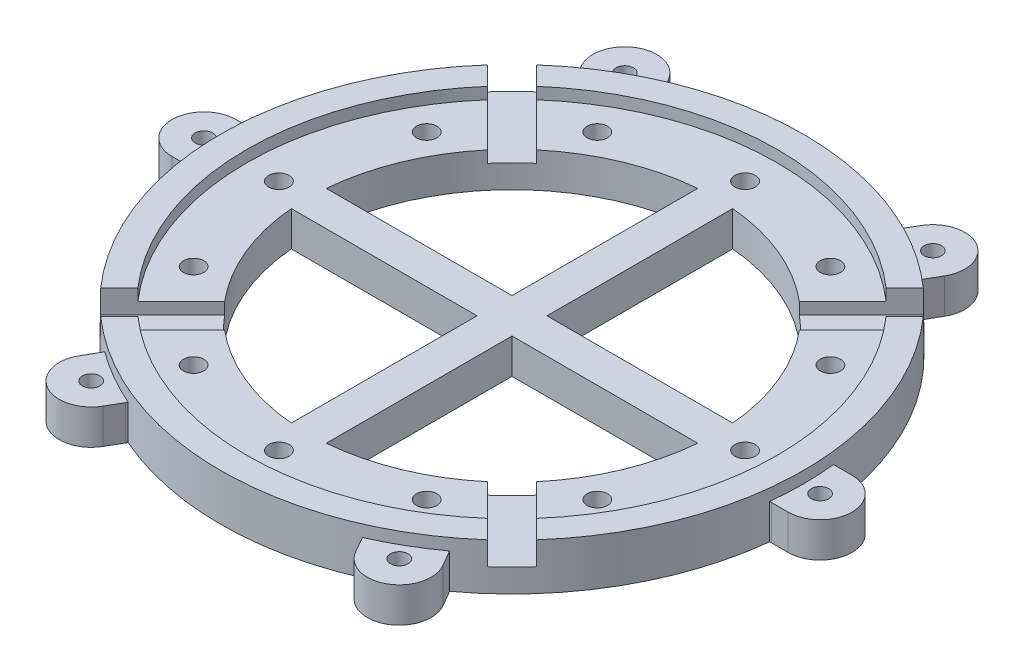
from build123d import *

# Parameters (mm, degrees)
SKETCH1_R           = 50
BOSS_EXTRUDE1_DEPTH = 8
SKETCH2_R           = 45.5
CUT_EXTRUDE1_DEPTH  = 2
SKETCH3_R           = 1.75
CUT_EXTRUDE2_DEPTH  = 72.161787499
SKETCH4_R           = 3.25
CUT_EXTRUDE3_DEPTH  = 3
BOSS_EXTRUDE2_DEPTH = 6
SKETCH6_R           = 1.5
CUT_EXTRUDE4_DEPTH  = 79.087932515
CUT_EXTRUDE6_DEPTH  = 78.908441164
CUT_EXTRUDE9_DEPTH  = 4


with BuildPart() as part:
    # Sketch1 → Boss-Extrude1 (new body)
    with BuildSketch(Plane(origin=(0, 0, 0), x_dir=(1, 0, 0), z_dir=(0, 1, 0))):
        with Locations(Location((0, 0, 0), (0, 0, 270))):
            Circle(SKETCH1_R)
    extrude(amount=BOSS_EXTRUDE1_DEPTH)

    # Sketch2 → Cut-Extrude1 (cut)
    with BuildSketch(Plane(origin=(0, 8, 0), x_dir=(1, 0, 0), z_dir=(0, 1, 0))):
        with Locations(Location((0, 0, 0), (0, 0, 270))):
            Circle(SKETCH2_R)
    extrude(amount=-CUT_EXTRUDE1_DEPTH, mode=Mode.SUBTRACT)

    # Sketch3 → Cut-Extrude2 (cut, through all)
    with BuildSketch(Plane.XZ):
        with Locations(Location((-40, 0, 0), (0, 0, 270))):
            Circle(SKETCH3_R)
        with Locations(Location((-34.641016151, 20, 0), (0, 0, 270))):
            Circle(SKETCH3_R)
        with Locations(Location((-20, 34.641016151, 0), (0, 0, 270))):
            Circle(SKETCH3_R)
        with Locations(Location((0, 40, 0), (0, 0, 270))):
            Circle(SKETCH3_R)
        with Locations(Location((20, 34.641016151, 0), (0, 0, 270))):
            Circle(SKETCH3_R)
        with Locations(Location((34.641016151, 20, 0), (0, 0, 270))):
            Circle(SKETCH3_R)
        with Locations(Location((40, 0, 0), (0, 0, 270))):
            Circle(SKETCH3_R)
        with Locations(Location((34.641016151, -20, 0), (0, 0, 270))):
            Circle(SKETCH3_R)
        with Locations(Location((20, -34.641016151, 0), (0, 0, 270))):
            Circle(SKETCH3_R)
        with Locations(Location((0, -40, 0), (0, 0, 270))):
            Circle(SKETCH3_R)
        with Locations(Location((-20, -34.641016151, 0), (0, 0, 270))):
            Circle(SKETCH3_R)
        with Locations(Location((-34.641016151, -20, 0), (0, 0, 270))):
            Circle(SKETCH3_R)
    extrude(amount=-CUT_EXTRUDE2_DEPTH, mode=Mode.SUBTRACT)

    # Sketch4 → Cut-Extrude3 (cut)
    with BuildSketch(Plane.XZ):
        with Locations(Location((-40, 0, 0), (0, 0, 270))):
            Circle(SKETCH4_R)
        with Locations(Location((-34.641016151, 20, 0), (0, 0, 270))):
            Circle(SKETCH4_R)
        with Locations(Location((-20, 34.641016151, 0), (0, 0, 270))):
            Circle(SKETCH4_R)
        with Locations(Location((0, 40, 0), (0, 0, 270))):
            Circle(SKETCH4_R)
        with Locations(Location((20, 34.641016151, 0), (0, 0, 270))):
            Circle(SKETCH4_R)
        with Locations(Location((34.641016151, 20, 0), (0, 0, 270))):
            Circle(SKETCH4_R)
        with Locations(Location((40, 0, 0), (0, 0, 270))):
            Circle(SKETCH4_R)
        with Locations(Location((34.641016151, -20, 0), (0, 0, 270))):
            Circle(SKETCH4_R)
        with Locations(Location((20, -34.641016151, 0), (0, 0, 270))):
            Circle(SKETCH4_R)
        with Locations(Location((0, -40, 0), (0, 0, 270))):
            Circle(SKETCH4_R)
        with Locations(Location((-20, -34.641016151, 0), (0, 0, 270))):
            Circle(SKETCH4_R)
        with Locations(Location((-34.641016151, -20, 0), (0, 0, 270))):
            Circle(SKETCH4_R)
    extrude(amount=-CUT_EXTRUDE3_DEPTH, mode=Mode.SUBTRACT)

    # Sketch5 → Boss-Extrude2 (add)
    with BuildSketch(Plane.XZ):
        with BuildLine():
            Line((50, 5.481362668), (52.872058145, 5.481362668))
            ThreePointArc((52.872058145, 5.481362668), (58.353420813, 0), (52.872058145, -5.481362668))
            Line((52.872058145, -5.481362668), (50, -5.481362668))
            ThreePointArc((50, -5.481362668), (49.849716822, -5.479302115), (49.699546633, -5.473122004))
            ThreePointArc((49.699546633, -5.473122004), (50, 0), (49.699546633, 5.473122004))
            ThreePointArc((49.699546633, 5.473122004), (49.849716822, 5.479302115), (50, 5.481362668))
        make_face()
        with BuildLine():
            Line((29.746999318, -40.560588855), (31.18302839, -43.04786417))
            ThreePointArc((31.18302839, -43.04786417), (29.176710406, -50.535544822), (21.689029755, -48.529226838))
            Line((21.689029755, -48.529226838), (20.253000682, -46.041951523))
            ThreePointArc((20.253000682, -46.041951523), (20.179643585, -45.910772197), (20.109910623, -45.777630943))
            ThreePointArc((20.109910623, -45.777630943), (25, -43.301270189), (29.58963601, -40.304508939))
            ThreePointArc((29.58963601, -40.304508939), (29.670073237, -40.431470082), (29.746999318, -40.560588855))
        make_face()
        with BuildLine():
            Line((-20.253000682, -46.041951523), (-21.689029755, -48.529226838))
            ThreePointArc((-21.689029755, -48.529226838), (-29.176710406, -50.535544822), (-31.18302839, -43.04786417))
            Line((-31.18302839, -43.04786417), (-29.746999318, -40.560588855))
            ThreePointArc((-29.746999318, -40.560588855), (-29.670073237, -40.431470082), (-29.58963601, -40.304508939))
            ThreePointArc((-29.58963601, -40.304508939), (-25, -43.301270189), (-20.109910623, -45.777630943))
            ThreePointArc((-20.109910623, -45.777630943), (-20.179643585, -45.910772197), (-20.253000682, -46.041951523))
        make_face()
        with BuildLine():
            Line((-50, -5.481362668), (-52.872058145, -5.481362668))
            ThreePointArc((-52.872058145, -5.481362668), (-58.353420813, 0), (-52.872058145, 5.481362668))
            Line((-52.872058145, 5.481362668), (-50, 5.481362668))
            ThreePointArc((-50, 5.481362668), (-49.849716822, 5.479302115), (-49.699546633, 5.473122004))
            ThreePointArc((-49.699546633, 5.473122004), (-50, 0), (-49.699546633, -5.473122004))
            ThreePointArc((-49.699546633, -5.473122004), (-49.849716822, -5.479302115), (-50, -5.481362668))
        make_face()
        with BuildLine():
            Line((-29.746999318, 40.560588855), (-31.18302839, 43.04786417))
            ThreePointArc((-31.18302839, 43.04786417), (-29.176710406, 50.535544822), (-21.689029755, 48.529226838))
            Line((-21.689029755, 48.529226838), (-20.253000682, 46.041951523))
            ThreePointArc((-20.253000682, 46.041951523), (-20.179643585, 45.910772197), (-20.109910623, 45.777630943))
            ThreePointArc((-20.109910623, 45.777630943), (-25, 43.301270189), (-29.58963601, 40.304508939))
            ThreePointArc((-29.58963601, 40.304508939), (-29.670073237, 40.431470082), (-29.746999318, 40.560588855))
        make_face()
        with BuildLine():
            Line((20.253000682, 46.041951523), (21.689029755, 48.529226838))
            ThreePointArc((21.689029755, 48.529226838), (29.176710406, 50.535544822), (31.18302839, 43.04786417))
            Line((31.18302839, 43.04786417), (29.746999318, 40.560588855))
            ThreePointArc((29.746999318, 40.560588855), (29.670073237, 40.431470082), (29.58963601, 40.304508939))
            ThreePointArc((29.58963601, 40.304508939), (25, 43.301270189), (20.109910623, 45.777630943))
            ThreePointArc((20.109910623, 45.777630943), (20.179643585, 45.910772197), (20.253000682, 46.041951523))
        make_face()
    extrude(amount=-BOSS_EXTRUDE2_DEPTH)

    # Sketch6 → Cut-Extrude4 (cut, through all)
    with BuildSketch(Plane.XZ):
        with Locations(Location((52.872058145, 0, 0), (0, 0, 270))):
            Circle(SKETCH6_R)
        with Locations(Location((26.436029072, -45.788545504, 0), (0, 0, 270))):
            Circle(SKETCH6_R)
        with Locations(Location((-26.436029072, -45.788545504, 0), (0, 0, 270))):
            Circle(SKETCH6_R)
        with Locations(Location((-52.872058145, 0, 0), (0, 0, 270))):
            Circle(SKETCH6_R)
        with Locations(Location((-26.436029072, 45.788545504, 0), (0, 0, 270))):
            Circle(SKETCH6_R)
        with Locations(Location((26.436029072, 45.788545504, 0), (0, 0, 270))):
            Circle(SKETCH6_R)
    extrude(amount=-CUT_EXTRUDE4_DEPTH, mode=Mode.SUBTRACT)

    # Sketch9 → Cut-Extrude6 (cut, through all)
    with BuildSketch(Plane(origin=(0, 6, 0), x_dir=(1, 0, 0), z_dir=(0, 1, 0))):
        with BuildLine():
            Line((-3, -3), (-3, -34.871191548))
            ThreePointArc((-3, -34.871191548), (-24.748737342, -24.748737342), (-34.871191548, -3))
            Line((-34.871191548, -3), (-3, -3))
        make_face()
        with BuildLine():
            Line((-3, 3), (-34.871191548, 3))
            ThreePointArc((-34.871191548, 3), (-24.748737342, 24.748737342), (-3, 34.871191548))
            Line((-3, 34.871191548), (-3, 3))
        make_face()
        with BuildLine():
            Line((3, 3), (3, 34.871191548))
            ThreePointArc((3, 34.871191548), (24.748737342, 24.748737342), (34.871191548, 3))
            Line((34.871191548, 3), (3, 3))
        make_face()
        with BuildLine():
            Line((3, -3), (34.871191548, -3))
            ThreePointArc((34.871191548, -3), (24.748737342, -24.748737342), (3, -34.871191548))
            Line((3, -34.871191548), (3, -3))
        make_face()
    extrude(amount=-CUT_EXTRUDE6_DEPTH, mode=Mode.SUBTRACT)

    # Sketch10 → Cut-Extrude9 (cut)
    with BuildSketch(Plane(origin=(0, 8, 0), x_dir=(1, 0, 0), z_dir=(0, 1, 0))):
        with BuildLine():
            Line((-24.054791846, 19.812151159), (-37.476659403, 33.234018716))
            ThreePointArc((-37.476659403, 33.234018716), (-37.476659403, 37.476659403), (-33.234018716, 37.476659403))
            Line((-33.234018716, 37.476659403), (-19.812151159, 24.054791846))
            ThreePointArc((-19.812151159, 24.054791846), (-22.035815668, 22.035815668), (-24.054791846, 19.812151159))
        make_face()
        with BuildLine():
            Line((19.812151159, 24.054791846), (33.234018716, 37.476659403))
            ThreePointArc((33.234018716, 37.476659403), (37.476659403, 37.476659403), (37.476659403, 33.234018716))
            Line((37.476659403, 33.234018716), (24.054791846, 19.812151159))
            ThreePointArc((24.054791846, 19.812151159), (22.035815668, 22.035815668), (19.812151159, 24.054791846))
        make_face()
        with BuildLine():
            Line((24.054791846, -19.812151159), (37.476659403, -33.234018716))
            ThreePointArc((37.476659403, -33.234018716), (37.476659403, -37.476659403), (33.234018716, -37.476659403))
            Line((33.234018716, -37.476659403), (19.812151159, -24.054791846))
            ThreePointArc((19.812151159, -24.054791846), (22.035815668, -22.035815668), (24.054791846, -19.812151159))
        make_face()
        with BuildLine():
            Line((-19.812151159, -24.054791846), (-33.234018716, -37.476659403))
            ThreePointArc((-33.234018716, -37.476659403), (-37.476659403, -37.476659403), (-37.476659403, -33.234018716))
            Line((-37.476659403, -33.234018716), (-24.054791846, -19.812151159))
            ThreePointArc((-24.054791846, -19.812151159), (-22.035815668, -22.035815668), (-19.812151159, -24.054791846))
        make_face()
    extrude(amount=-CUT_EXTRUDE9_DEPTH, mode=Mode.SUBTRACT)


solid = part.part
